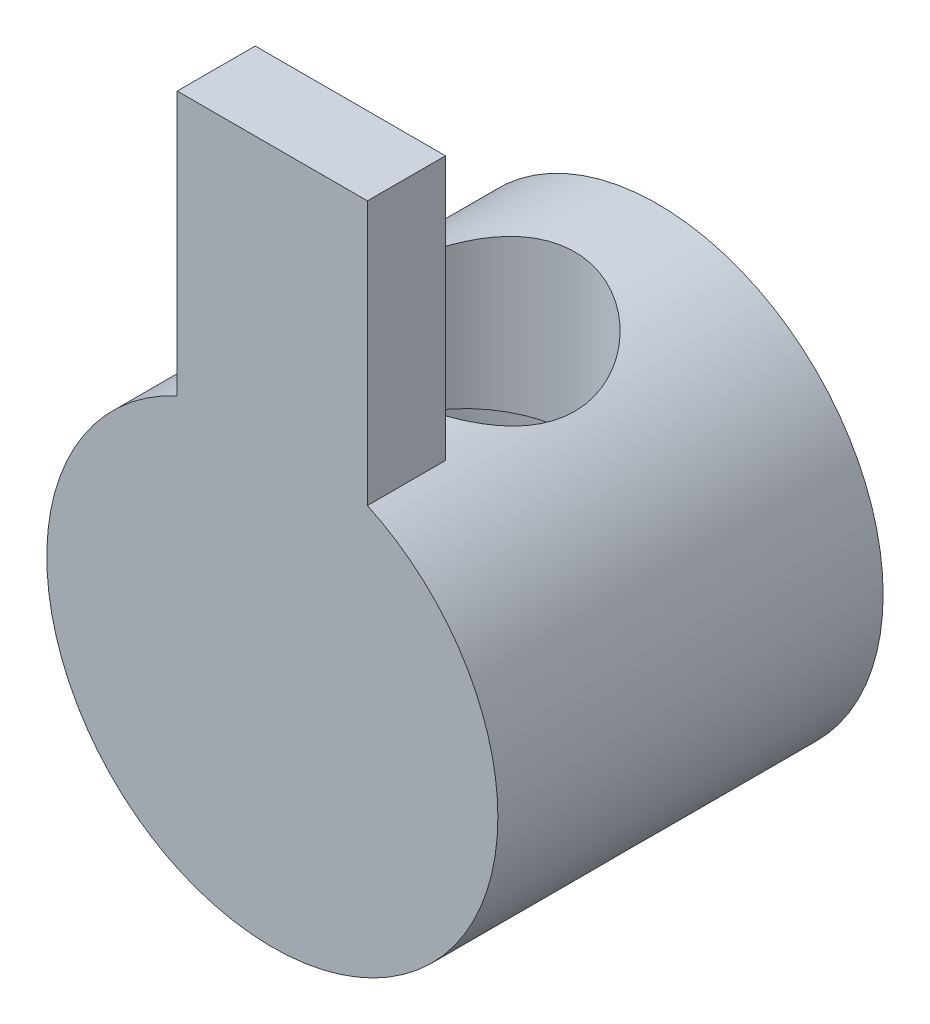
from build123d import *

# Parameters (mm, degrees)
SKETCH_1_W          = 7.8
SKETCH_1_H          = 28.46
EXTRUDE_1_DEPTH     = 3.2
SKETCH_4_W          = 7.8
SKETCH_4_H          = 7.178435562
CUT_EXTRUDE_1_DEPTH = 16.097777982
SKETCH_2_R          = 9.25
EXTRUDE_2_DEPTH     = 15.8
SKETCH_5_R          = 4.5
CUT_EXTRUDE_2_DEPTH = 33.469895288
SKETCH_6_R          = 6.75
CUT_EXTRUDE_3_DEPTH = 12


with BuildPart() as part:
    # 草图1 → 凸台-拉伸1 (new body)
    with BuildSketch(Plane.XY):
        Rectangle(SKETCH_1_W, SKETCH_1_H)
    extrude(amount=EXTRUDE_1_DEPTH)

    # 草图4 → 切除-拉伸1 (cut, through all)
    with BuildSketch(Plane(origin=(0, 0, 0), x_dir=(-1, 0, 0), z_dir=(0, 0, -1))):
        with Locations((0, -10.640782219)):
            Rectangle(SKETCH_4_W, SKETCH_4_H)
    extrude(amount=-CUT_EXTRUDE_1_DEPTH, mode=Mode.SUBTRACT)

    # 草图2 → 凸台-拉伸2 (add)
    with BuildSketch(Plane.XY.offset(3.2)):
        with Locations((0, -4.98)):
            Circle(SKETCH_2_R)
    extrude(amount=-EXTRUDE_2_DEPTH)

    # 草图5 → 切除-拉伸2 (cut, through all)
    with BuildSketch(Plane(origin=(0, 14.23, 0), x_dir=(1, 0, 0), z_dir=(0, 1, 0))):
        with Locations(Location((0, 4.7, 0), (0, 0, 270))):
            Circle(SKETCH_5_R)
    extrude(amount=-CUT_EXTRUDE_2_DEPTH, mode=Mode.SUBTRACT)

    # 草图6 → 切除-拉伸3 (cut)
    with BuildSketch(Plane(origin=(0, -14.23, 0), x_dir=(-1, 0, 0), z_dir=(0, 1, 0))):
        with Locations(Location((0, -4.7, 0), (0, 0, 270))):
            Circle(SKETCH_6_R)
    extrude(amount=CUT_EXTRUDE_3_DEPTH, mode=Mode.SUBTRACT)


solid = part.part
